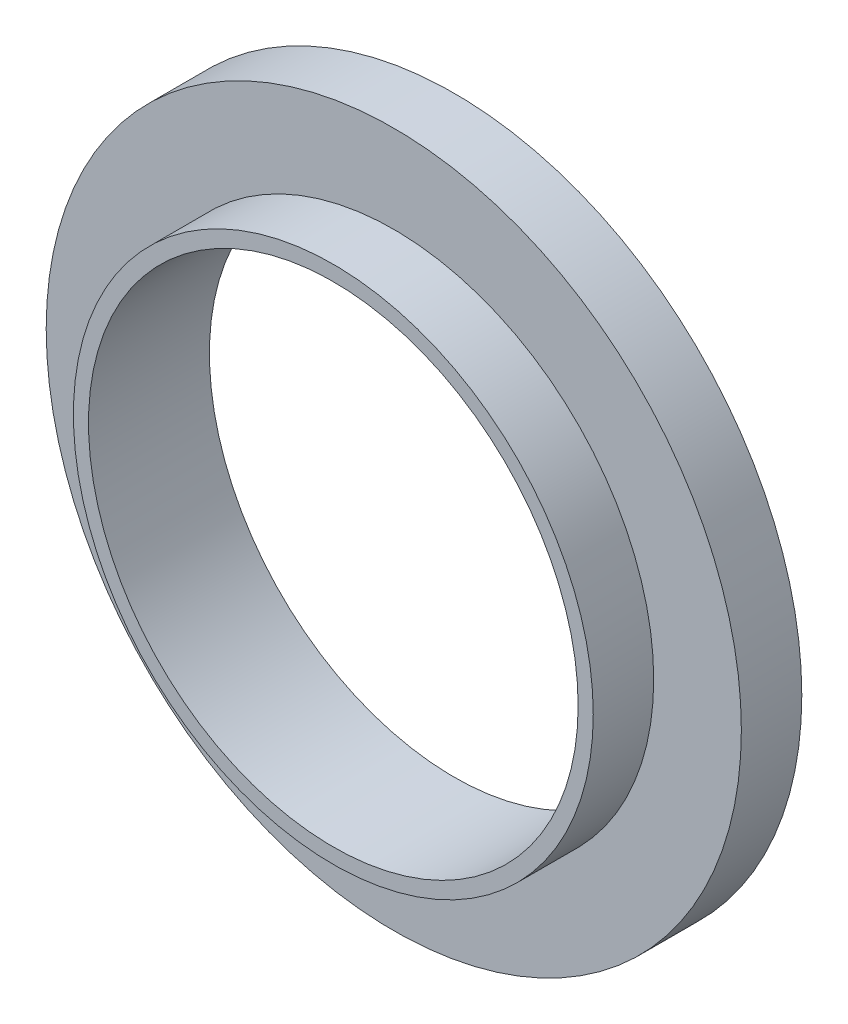
from build123d import *

# Parameters (mm, degrees)
ESBO_O1_R                = 57.5
ESBO_O1_R_2              = 43
RESSALTO_EXTRUS_O1_DEPTH = 10
ESBO_O1_4_R              = 43
ESBO_O1_4_R_2            = 40.5
RESSALTO_EXTRUS_O2_DEPTH = 20


with BuildPart() as part:
    # Esboço1 → Ressalto-extrusão1 (new body)
    with BuildSketch(Plane.XY):
        Circle(ESBO_O1_R)
        Circle(ESBO_O1_R_2, mode=Mode.SUBTRACT)
    extrude(amount=RESSALTO_EXTRUS_O1_DEPTH)

    # Esboço1<4> → Ressalto-extrusão2 (add)
    with BuildSketch(Plane.XY):
        Circle(ESBO_O1_4_R)
        Circle(ESBO_O1_4_R_2, mode=Mode.SUBTRACT)
    extrude(amount=RESSALTO_EXTRUS_O2_DEPTH)


solid = part.part
